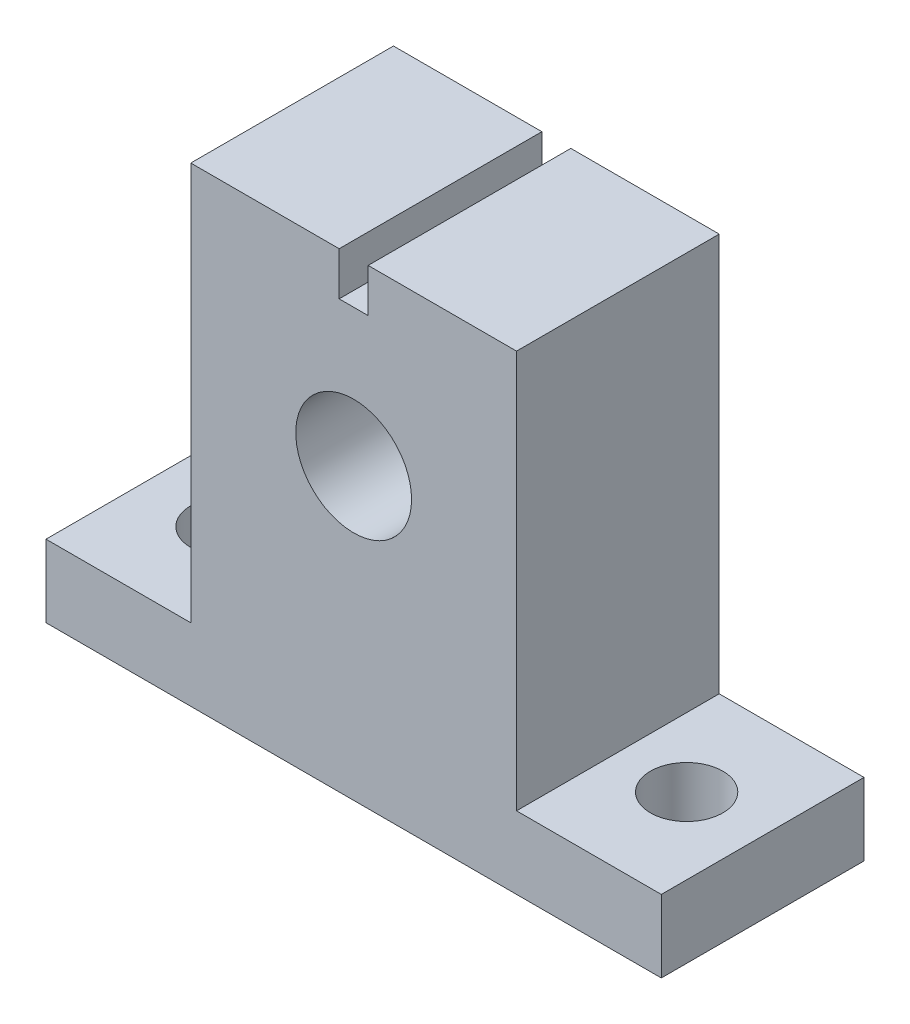
from build123d import *

# Parameters (mm, degrees)
BOSS_EXTRUDE1_DEPTH = 14
SKETCH2_R           = 4
CUT_EXTRUDE1_DEPTH  = 56.303706928
SKETCH3_R           = 2.5
CUT_EXTRUDE2_DEPTH  = 14
SKETCH4_R           = 2.5
CUT_EXTRUDE3_DEPTH  = 14
SKETCH5_W           = 2
SKETCH5_H           = 14
CUT_EXTRUDE4_DEPTH  = 3


with BuildPart() as part:
    # Sketch1 → Boss-Extrude1 (new body)
    with BuildSketch(Plane.XY):
        Polygon((0, 0), (42.5, 0), (42.5, 5), (32.5, 5), (32.5, 32.5), (10, 32.5), (10, 5), (0, 5), align=None)
    extrude(amount=BOSS_EXTRUDE1_DEPTH)

    # Sketch2 → Cut-Extrude1 (cut, through all)
    with BuildSketch(Plane.XY.offset(14)):
        with Locations((21.25, 20)):
            Circle(SKETCH2_R)
    extrude(amount=-CUT_EXTRUDE1_DEPTH, mode=Mode.SUBTRACT)

    # Sketch3 → Cut-Extrude2 (cut)
    with BuildSketch(Plane(origin=(0, 5, 0), x_dir=(1, 0, 0), z_dir=(0, 1, 0))):
        with Locations(Location((5.5, -7, 0), (0, 0, 270))):
            Circle(SKETCH3_R)
    extrude(amount=-CUT_EXTRUDE2_DEPTH, mode=Mode.SUBTRACT)

    # Sketch4 → Cut-Extrude3 (cut)
    with BuildSketch(Plane(origin=(0, 5, 0), x_dir=(1, 0, 0), z_dir=(0, 1, 0))):
        with Locations(Location((37.25, -7, 0), (0, 0, 180))):
            Circle(SKETCH4_R)
    extrude(amount=-CUT_EXTRUDE3_DEPTH, mode=Mode.SUBTRACT)

    # Sketch5 → Cut-Extrude4 (cut)
    with BuildSketch(Plane(origin=(0, 32.5, 0), x_dir=(1, 0, 0), z_dir=(0, 1, 0))):
        with Locations((21.25, -7)):
            Rectangle(SKETCH5_W, SKETCH5_H)
    extrude(amount=-CUT_EXTRUDE4_DEPTH, mode=Mode.SUBTRACT)


solid = part.part
